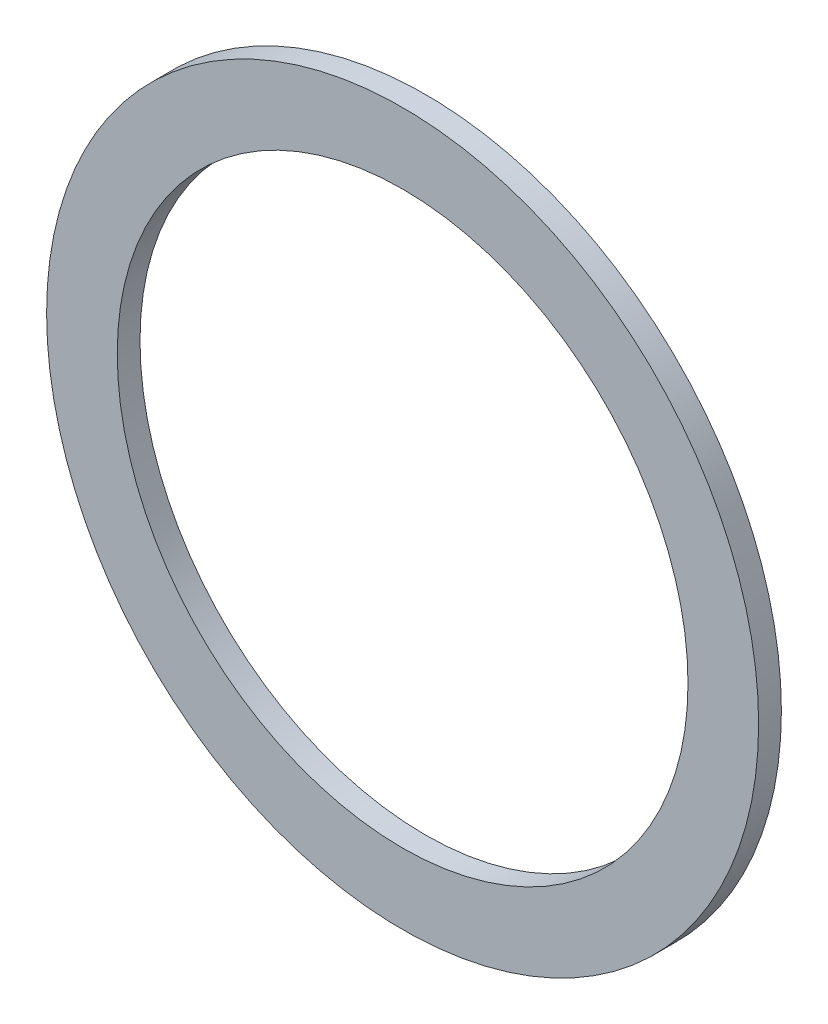
from build123d import *

# Parameters (mm, degrees)
SKETCH1_R           = 49.6697
SKETCH1_R_2         = 39.8145
BOSS_EXTRUDE1_DEPTH = 3.175


with BuildPart() as part:
    # Sketch1 → Boss-Extrude1 (new body)
    with BuildSketch(Plane.XY):
        Circle(SKETCH1_R)
        Circle(SKETCH1_R_2, mode=Mode.SUBTRACT)
    extrude(amount=BOSS_EXTRUDE1_DEPTH)


solid = part.part
